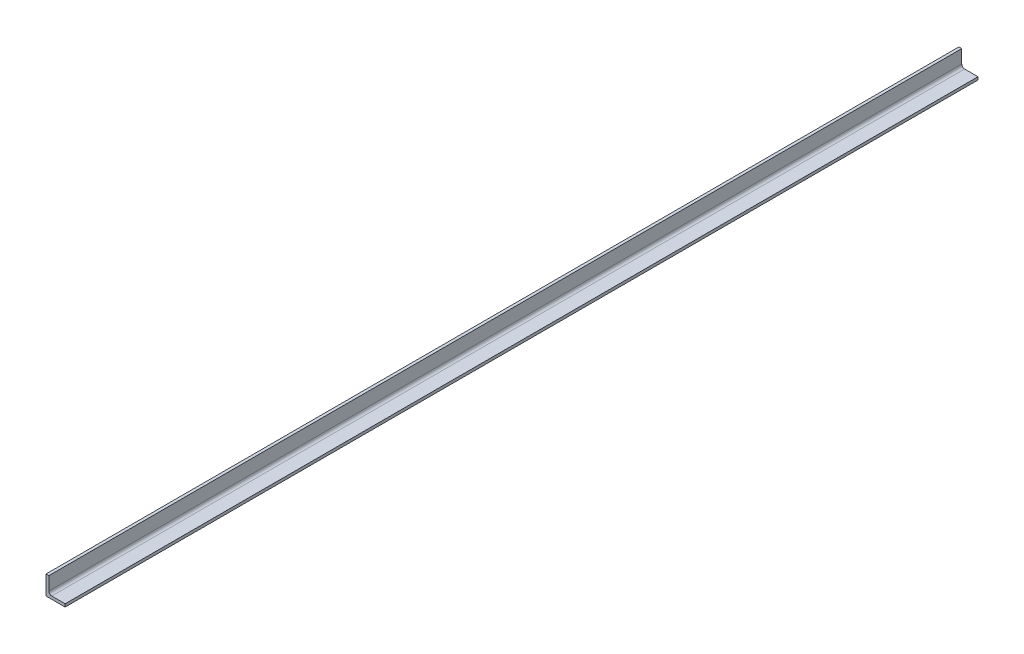
from build123d import *

# Parameters (mm, degrees)
BOSS_EXTRU_1_DEPTH = 955


with BuildPart() as part:
    # Esquisse1 → Boss.-Extru.1 (new body)
    with BuildSketch(Plane.XY):
        with BuildLine():
            Line((0, 0), (0, 20))
            Line((0, 20), (3, 20))
            Line((3, 20), (3, 6))
            ThreePointArc((3, 6), (3.878679656, 3.878679656), (6, 3))
            Line((6, 3), (20, 3))
            Line((20, 3), (20, 0))
            Line((20, 0), (0, 0))
        make_face()
    extrude(amount=BOSS_EXTRU_1_DEPTH)


solid = part.part
